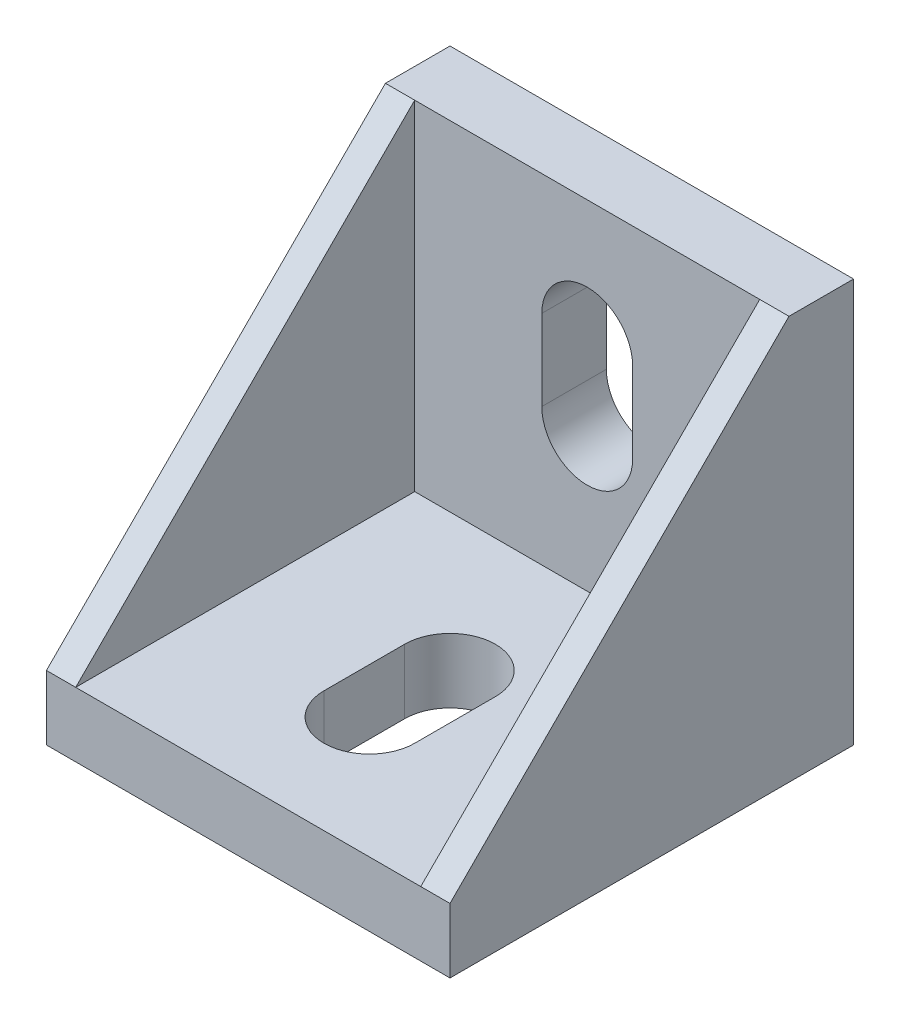
from build123d import *

# Parameters (mm, degrees)
SKETCH1_W           = 20
SKETCH1_H           = 20
BOSS_EXTRUDE1_DEPTH = 20
CUT_EXTRUDE2_DEPTH  = 28
CUT_EXTRUDE3_DEPTH  = 8.55
CUT_EXTRUDE4_DEPTH  = 17.1
CUT_EXTRUDE5_DEPTH  = 17.1


with BuildPart() as part:
    # Sketch1 → Boss-Extrude1 (new body)
    with BuildSketch(Plane.XY):
        Rectangle(SKETCH1_W, SKETCH1_H)
    extrude(amount=BOSS_EXTRUDE1_DEPTH)

    # Sketch3 → Cut-Extrude2 (cut)
    with BuildSketch(Plane(origin=(10, 0, 0), x_dir=(0, 0, -1), z_dir=(1, 0, 0))):
        Polygon((-3.2, 10), (-20, -6.8), (-20, 10), align=None)
    extrude(amount=-CUT_EXTRUDE2_DEPTH, mode=Mode.SUBTRACT)

    # Sketch6 → Cut-Extrude3 (cut, symmetric)
    with BuildSketch(Plane.ZY):
        Polygon((3.2, 10), (3.2, -6.8), (20, -6.8), align=None)
    extrude(amount=CUT_EXTRUDE3_DEPTH, both=True, mode=Mode.SUBTRACT)

    # Sketch7 → Cut-Extrude4 (cut)
    with BuildSketch(Plane.XY.offset(3.2)):
        with BuildLine():
            Line((-2.25, 0), (-2.25, 4))
            ThreePointArc((-2.25, 4), (0, 6.25), (2.25, 4))
            Line((2.25, 4), (2.25, 0))
            ThreePointArc((2.25, 0), (0, -2.25), (-2.25, 0))
        make_face()
    extrude(amount=-CUT_EXTRUDE4_DEPTH, mode=Mode.SUBTRACT)

    # Sketch9 → Cut-Extrude5 (cut)
    with BuildSketch(Plane(origin=(0, -6.8, 0), x_dir=(1, 0, 0), z_dir=(0, 1, 0))):
        with BuildLine():
            Line((2.25, -10), (2.25, -14))
            ThreePointArc((2.25, -14), (0, -16.25), (-2.25, -14))
            Line((-2.25, -14), (-2.25, -10))
            ThreePointArc((-2.25, -10), (0, -7.75), (2.25, -10))
        make_face()
    extrude(amount=-CUT_EXTRUDE5_DEPTH, mode=Mode.SUBTRACT)


solid = part.part
